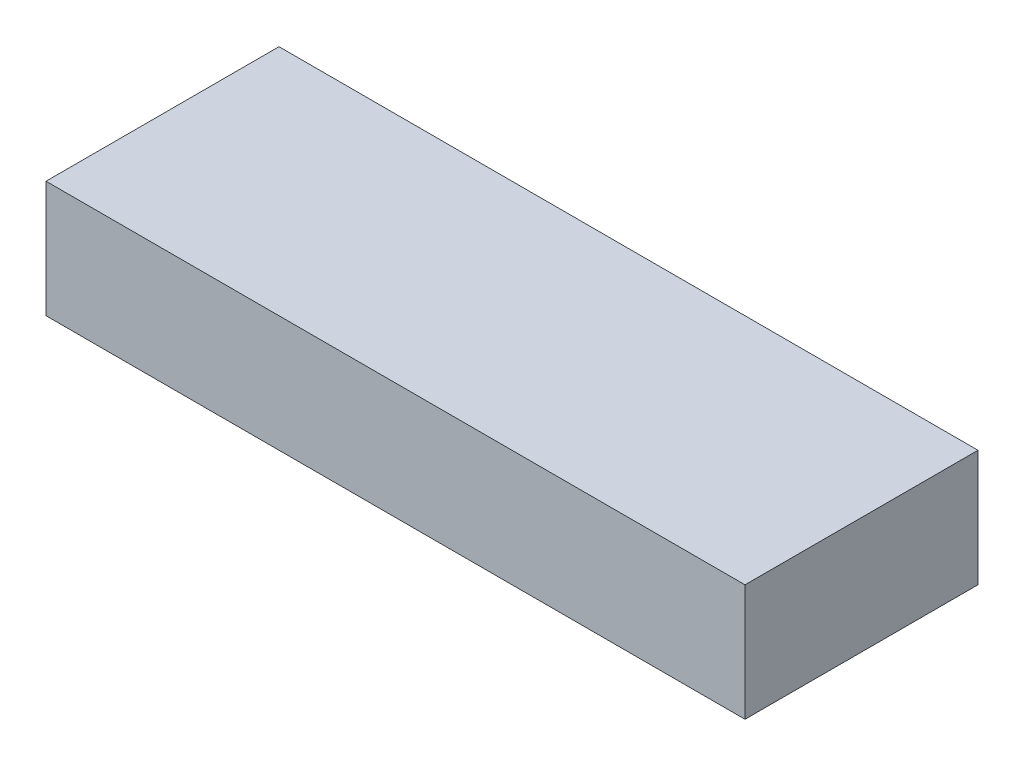
from build123d import *

# Parameters (mm, degrees)
SKETCH1_W           = 3000
SKETCH1_H           = 1000
BOSS_EXTRUDE1_DEPTH = 500


with BuildPart() as part:
    # Sketch1 → Boss-Extrude1 (new body)
    with BuildSketch(Plane(origin=(0, 0, 0), x_dir=(1, 0, 0), z_dir=(0, 1, 0))):
        Rectangle(SKETCH1_W, SKETCH1_H)
    extrude(amount=BOSS_EXTRUDE1_DEPTH)


solid = part.part
